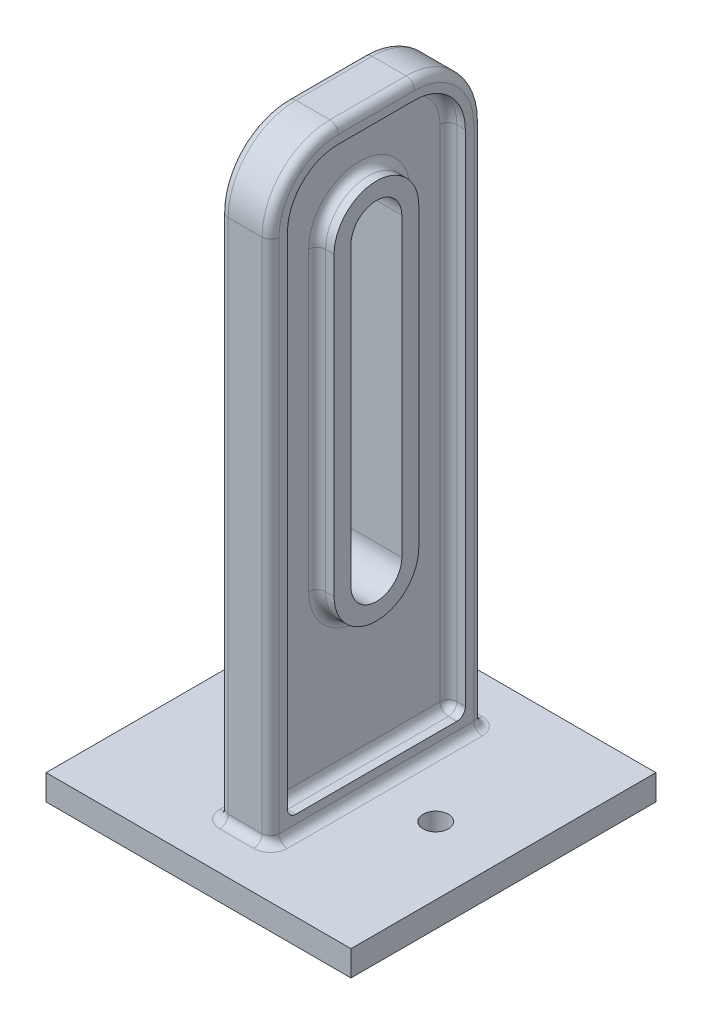
from build123d import *

# Parameters (mm, degrees)
SKETCH1_W           = 36
SKETCH1_H           = 36
BOSS_EXTRUDE1_DEPTH = 3
SKETCH2_R           = 1.5
CUT_EXTRUDE1_DEPTH  = 3
SKETCH3_W           = 6
SKETCH3_H           = 25
BOSS_EXTRUDE2_DEPTH = 70
CUT_EXTRUDE2_DEPTH  = 70
FILLET1_R           = 8
CUT_EXTRUDE3_DEPTH  = 2
FILLET3_R           = 1
FILLET4_R           = 1
FILLET5_R           = 1
FILLET6_R           = 1
FILLET8_R           = 1
FILLET9_R           = 1
FILLET10_R          = 1
FILLET11_R          = 1


with BuildPart() as part:
    # Sketch1 → Boss-Extrude1 (new body)
    with BuildSketch(Plane(origin=(0, 0, 0), x_dir=(1, 0, 0), z_dir=(0, 1, 0))):
        Rectangle(SKETCH1_W, SKETCH1_H)
    extrude(amount=BOSS_EXTRUDE1_DEPTH)

    # Sketch2 → Cut-Extrude1 (cut)
    with BuildSketch(Plane(origin=(0, 3, 0), x_dir=(1, 0, 0), z_dir=(0, 1, 0))):
        with Locations(Location((10, 0, 0), (0, 0, 270))):
            Circle(SKETCH2_R)
        with Locations(Location((-10, 0, 0), (0, 0, 270))):
            Circle(SKETCH2_R)
    extrude(amount=-CUT_EXTRUDE1_DEPTH, mode=Mode.SUBTRACT)

    # Sketch3 → Boss-Extrude2 (add)
    with BuildSketch(Plane(origin=(0, 3, 0), x_dir=(1, 0, 0), z_dir=(0, 1, 0))):
        Rectangle(SKETCH3_W, SKETCH3_H)
    extrude(amount=BOSS_EXTRUDE2_DEPTH)

    # Sketch5 → Cut-Extrude2 (cut)
    with BuildSketch(Plane(origin=(3, 0, 0), x_dir=(0, 0, -1), z_dir=(1, 0, 0))):
        with BuildLine():
            Line((3, 60), (3, 25))
            ThreePointArc((3, 25), (0, 22), (-3, 25))
            Line((-3, 25), (-3, 60))
            ThreePointArc((-3, 60), (0, 63), (3, 60))
        make_face()
    extrude(amount=-CUT_EXTRUDE2_DEPTH, mode=Mode.SUBTRACT)

    # Fillet1
    fillet1_edges = [part.edges().sort_by_distance(p)[0] for p in [
        (0, 73, -12.5),
        (0, 73, 12.5),
    ]]
    fillet(fillet1_edges, radius=FILLET1_R)

    # Sketch6 → Cut-Extrude3 (cut)
    with BuildSketch(Plane(origin=(3, 0, 0), x_dir=(0, 0, -1), z_dir=(1, 0, 0))):
        with BuildLine():
            Line((10.5, 5), (10.5, 65))
            ThreePointArc((10.5, 65), (8.742640687, 69.242640687), (4.5, 71))
            Line((4.5, 71), (-4.5, 71))
            ThreePointArc((-4.5, 71), (-8.742640687, 69.242640687), (-10.5, 65))
            Line((-10.5, 65), (-10.5, 5))
            Line((-10.5, 5), (10.5, 5))
        make_face()
        with BuildLine():
            Line((-5, 60), (-5, 25))
            ThreePointArc((-5, 25), (0, 20), (5, 25))
            Line((5, 25), (5, 60))
            ThreePointArc((5, 60), (0, 65), (-5, 60))
        make_face(mode=Mode.SUBTRACT)
    cut_extrude3 = extrude(amount=-CUT_EXTRUDE3_DEPTH, mode=Mode.SUBTRACT)

    # Mirror1: Cut-Extrude3 across plane
    add(cut_extrude3.mirror(Plane(origin=(0, 0, 0), x_dir=(0, 0, 1), z_dir=(1, 0, 0))), mode=Mode.SUBTRACT)

    # Fillet3
    fillet3_edges = [part.edges().sort_by_distance(p)[0] for p in [
        (-1, 20, 0),
        (-1, 42.5, -5),
        (-1, 65, 0),
        (-1, 42.5, 5),
    ]]
    fillet(fillet3_edges, radius=FILLET3_R)

    # Fillet4
    fillet4_edges = [part.edges().sort_by_distance(p)[0] for p in [
        (-1, 35, -10.5),
        (-1, 69.242640687, -8.742640687),
        (-1, 71, 0),
        (-1, 69.242640687, 8.742640687),
        (-1, 35, 10.5),
    ]]
    fillet(fillet4_edges, radius=FILLET4_R)

    # Fillet5
    fillet5_edges = [part.edges().sort_by_distance(p)[0] for p in [
        (3, 73, 0),
        (-3, 73, 0),
        (-3, 34, 12.5),
        (-3, 34, -12.5),
        (-3, 70.656854249, 10.156854249),
        (-3, 70.656854249, -10.156854249),
        (3, 34, -12.5),
        (3, 34, 12.5),
        (3, 70.656854249, 10.156854249),
        (3, 70.656854249, -10.156854249),
    ]]
    fillet(fillet5_edges, radius=FILLET5_R)

    # Fillet6
    fillet6_edges = [part.edges().sort_by_distance(p)[0] for p in [
        (-2.5, 5, -10.5),
        (-1, 5, 0),
        (-2.5, 5, 10.5),
        (-1.292893219, 5, 10.207106781),
        (-1.292893219, 5, -10.207106781),
    ]]
    fillet(fillet6_edges, radius=FILLET6_R)

    # Fillet8
    fillet8_edges = [part.edges().sort_by_distance(p)[0] for p in [
        (3, 3, 0),
        (0, 3, 12.5),
        (-3, 3, 0),
        (0, 3, -12.5),
        (2.707106781, 3, 12.207106781),
        (-2.707106781, 3, 12.207106781),
        (2.707106781, 3, -12.207106781),
        (-2.707106781, 3, -12.207106781),
    ]]
    fillet(fillet8_edges, radius=FILLET8_R)

    # Fillet9
    fillet9_edges = [part.edges().sort_by_distance(p)[0] for p in [
        (1, 5, 0),
    ]]
    fillet(fillet9_edges, radius=FILLET9_R)

    # Fillet10
    fillet10_edges = [part.edges().sort_by_distance(p)[0] for p in [
        (1, 42.5, 5),
        (1, 20, 0),
        (1, 42.5, -5),
        (1, 65, 0),
    ]]
    fillet(fillet10_edges, radius=FILLET10_R)

    # Fillet11
    fillet11_edges = [part.edges().sort_by_distance(p)[0] for p in [
        (1, 35.5, -10.5),
        (2.5, 5, -10.5),
        (1.292893219, 5.292893219, -10.5),
        (2.5, 5, 10.5),
        (1.292893219, 5.292893219, 10.5),
        (1, 35.5, 10.5),
        (1, 69.242640687, 8.742640687),
        (1, 71, 0),
        (1, 69.242640687, -8.742640687),
    ]]
    fillet(fillet11_edges, radius=FILLET11_R)


solid = part.part
